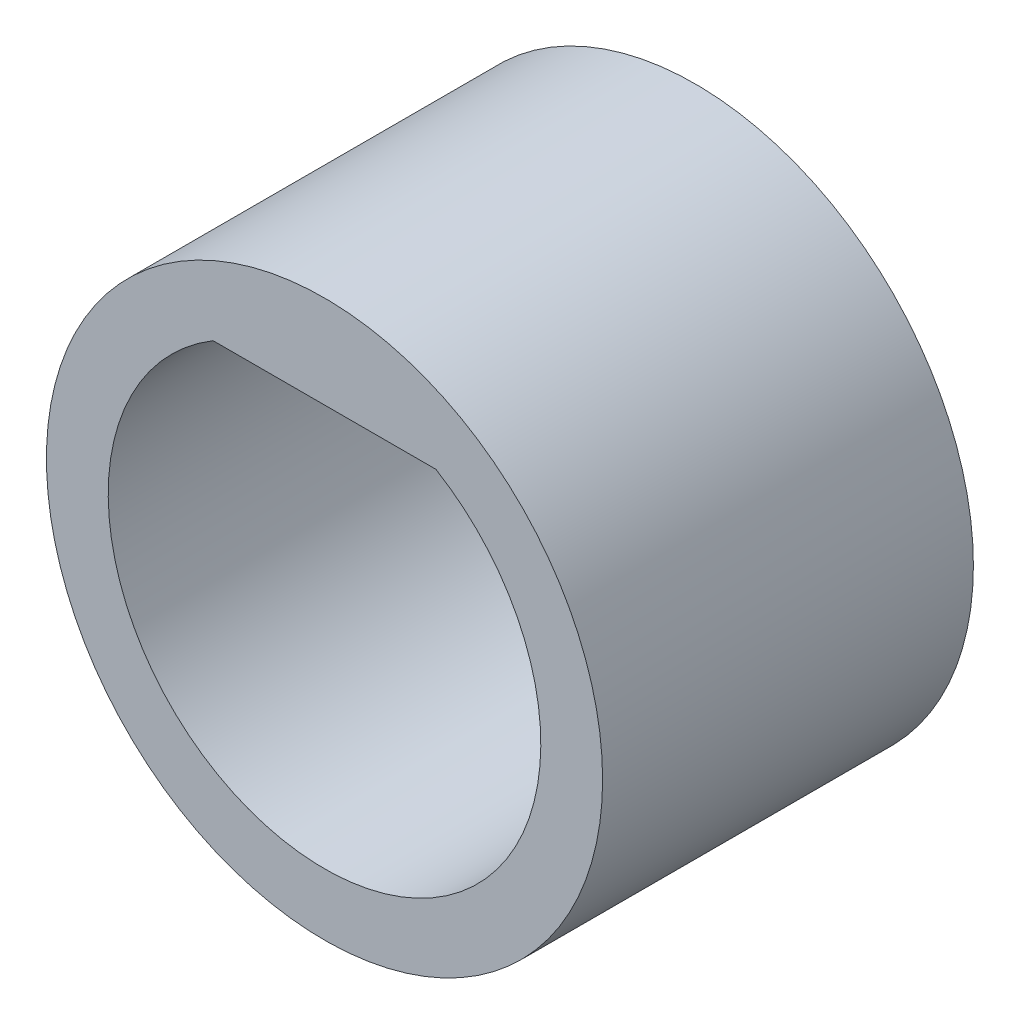
from build123d import *

# Parameters (mm, degrees)
SKETCH1_R               = 4.5
BOSS_EXTRUDE1_DEPTH     = 6
CUT_EXTRUDE1_DEPTH      = 9.746427842
CUT_EXTRUDE1_DEPTH_BACK = 5


with BuildPart() as part:
    # Sketch1 → Boss-Extrude1 (new body)
    with BuildSketch(Plane.XY):
        Circle(SKETCH1_R)
    extrude(amount=BOSS_EXTRUDE1_DEPTH)

    # Sketch2 → Cut-Extrude1 (cut, two sides: drawn at the far end of the back side and taken through both)
    with BuildSketch(Plane.XY.offset(6).offset(-CUT_EXTRUDE1_DEPTH_BACK)):
        with BuildLine():
            Line((-1.802775638, 3), (1.802775638, 3))
            ThreePointArc((1.802775638, 3), (0, -3.5), (-1.802775638, 3))
        make_face()
    extrude(amount=CUT_EXTRUDE1_DEPTH + CUT_EXTRUDE1_DEPTH_BACK, mode=Mode.SUBTRACT)


solid = part.part
